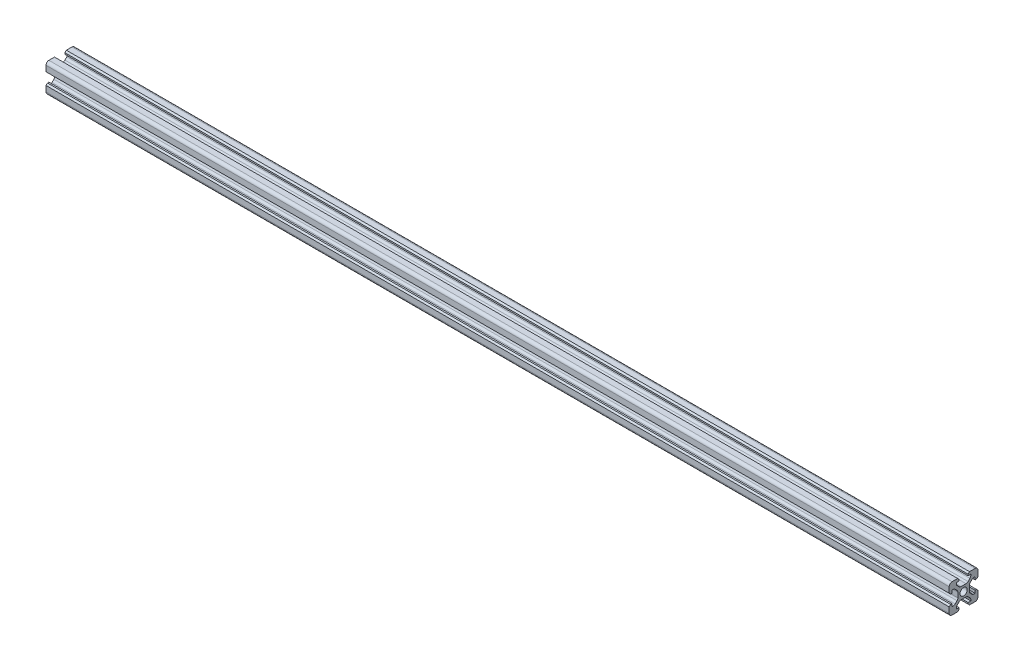
from build123d import *

# Parameters (mm, degrees)
SKETCH1_R           = 2.5
BOSS_EXTRUDE1_DEPTH = 626


with BuildPart() as part:
    # Sketch1 → Boss-Extrude1 (new body)
    with BuildSketch(Plane(origin=(0, 0, 0), x_dir=(0, 0, -1), z_dir=(1, 0, 0))):
        with BuildLine():
            Line((-4.1, 10), (-8, 10))
            ThreePointArc((-8, 10), (-9.414213562, 9.414213562), (-10, 8))
            Line((-10, 8), (-10, 4.1))
            Line((-10, 4.1), (-9, 3.1))
            Line((-9, 3.1), (-8, 3.1))
            Line((-8, 3.1), (-8, 5))
            Line((-8, 5), (-7.242640687, 5))
            ThreePointArc((-7.242640687, 5), (-6.477273822, 4.847759065), (-5.828427125, 4.414213562))
            Line((-5.828427125, 4.414213562), (-4.537854624, 3.123641061))
            ThreePointArc((-4.537854624, 3.123641061), (-4.104309121, 2.474794364), (-3.952068186, 1.709427499))
            Line((-3.952068186, 1.709427499), (-3.952068186, -1.709427499))
            ThreePointArc((-3.952068186, -1.709427499), (-4.104309121, -2.474794364), (-4.537854624, -3.123641061))
            Line((-4.537854624, -3.123641061), (-5.828427125, -4.414213562))
            ThreePointArc((-5.828427125, -4.414213562), (-6.477273822, -4.847759065), (-7.242640687, -5))
            Line((-7.242640687, -5), (-8, -5))
            Line((-8, -5), (-8, -3.1))
            Line((-8, -3.1), (-9, -3.1))
            Line((-9, -3.1), (-10, -4.1))
            Line((-10, -4.1), (-10, -8))
            ThreePointArc((-10, -8), (-9.414213562, -9.414213562), (-8, -10))
            Line((-8, -10), (-4.1, -10))
            Line((-4.1, -10), (-3.1, -9))
            Line((-3.1, -9), (-3.1, -8))
            Line((-3.1, -8), (-5, -8))
            Line((-5, -8), (-5, -7.242640687))
            ThreePointArc((-5, -7.242640687), (-4.847759065, -6.477273822), (-4.414213562, -5.828427125))
            Line((-4.414213562, -5.828427125), (-3.123641061, -4.537854624))
            ThreePointArc((-3.123641061, -4.537854624), (-2.474794364, -4.104309121), (-1.709427499, -3.952068186))
            Line((-1.709427499, -3.952068186), (1.709427499, -3.952068186))
            ThreePointArc((1.709427499, -3.952068186), (2.474794364, -4.104309121), (3.123641061, -4.537854624))
            Line((3.123641061, -4.537854624), (4.414213562, -5.828427125))
            ThreePointArc((4.414213562, -5.828427125), (4.847759065, -6.477273822), (5, -7.242640687))
            Line((5, -7.242640687), (5, -8))
            Line((5, -8), (3.1, -8))
            Line((3.1, -8), (3.1, -9))
            Line((3.1, -9), (4.1, -10))
            Line((4.1, -10), (8, -10))
            ThreePointArc((8, -10), (9.414213562, -9.414213562), (10, -8))
            Line((10, -8), (10, -4.1))
            Line((10, -4.1), (9, -3.1))
            Line((9, -3.1), (8, -3.1))
            Line((8, -3.1), (8, -5))
            Line((8, -5), (7.242640687, -5))
            ThreePointArc((7.242640687, -5), (6.477273822, -4.847759065), (5.828427125, -4.414213562))
            Line((5.828427125, -4.414213562), (4.537854624, -3.123641061))
            ThreePointArc((4.537854624, -3.123641061), (4.104309121, -2.474794364), (3.952068186, -1.709427499))
            Line((3.952068186, -1.709427499), (3.952068186, 1.709427499))
            ThreePointArc((3.952068186, 1.709427499), (4.104309121, 2.474794364), (4.537854624, 3.123641061))
            Line((4.537854624, 3.123641061), (5.828427125, 4.414213562))
            ThreePointArc((5.828427125, 4.414213562), (6.477273822, 4.847759065), (7.242640687, 5))
            Line((7.242640687, 5), (8, 5))
            Line((8, 5), (8, 3.1))
            Line((8, 3.1), (9, 3.1))
            Line((9, 3.1), (10, 4.1))
            Line((10, 4.1), (10, 8))
            ThreePointArc((10, 8), (9.414213562, 9.414213562), (8, 10))
            Line((8, 10), (4.1, 10))
            Line((4.1, 10), (3.1, 9))
            Line((3.1, 9), (3.1, 8))
            Line((3.1, 8), (5, 8))
            Line((5, 8), (5, 7.242640687))
            ThreePointArc((5, 7.242640687), (4.847759065, 6.477273822), (4.414213562, 5.828427125))
            Line((4.414213562, 5.828427125), (3.123641061, 4.537854624))
            ThreePointArc((3.123641061, 4.537854624), (2.474794364, 4.104309121), (1.709427499, 3.952068186))
            Line((1.709427499, 3.952068186), (-1.709427499, 3.952068186))
            ThreePointArc((-1.709427499, 3.952068186), (-2.474794364, 4.104309121), (-3.123641061, 4.537854624))
            Line((-3.123641061, 4.537854624), (-4.414213562, 5.828427125))
            ThreePointArc((-4.414213562, 5.828427125), (-4.847759065, 6.477273822), (-5, 7.242640687))
            Line((-5, 7.242640687), (-5, 8))
            Line((-5, 8), (-3.1, 8))
            Line((-3.1, 8), (-3.1, 9))
            Line((-3.1, 9), (-4.1, 10))
        make_face()
        Circle(SKETCH1_R, mode=Mode.SUBTRACT)
    extrude(amount=BOSS_EXTRUDE1_DEPTH)


solid = part.part
